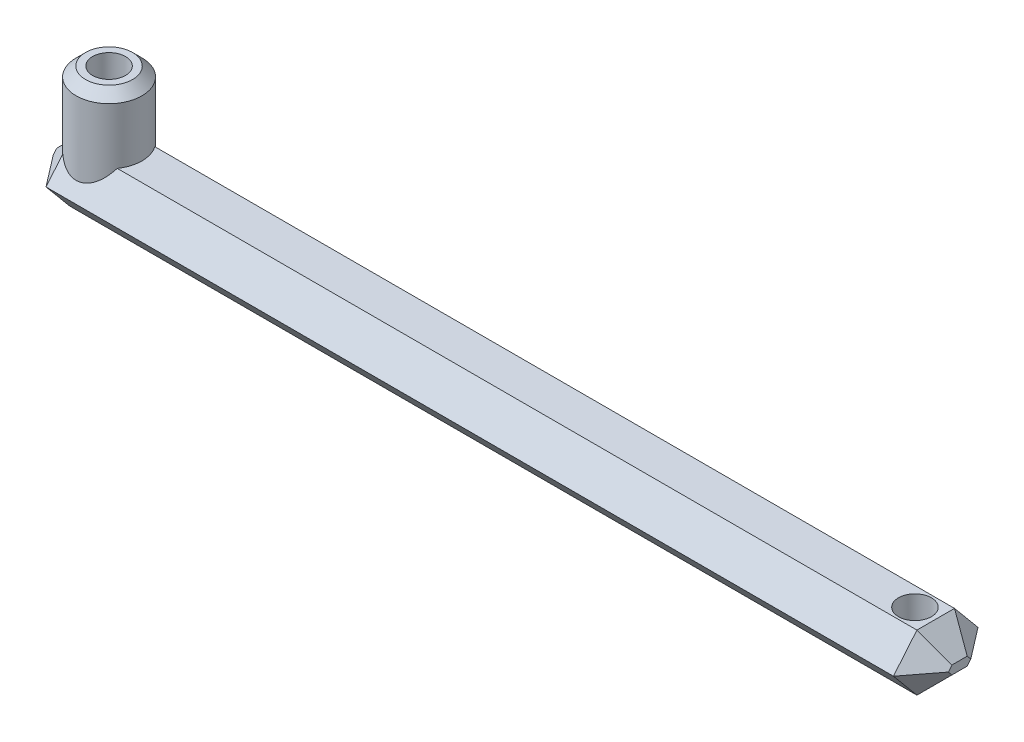
from build123d import *

# Parameters (mm, degrees)
BOSS_EXTRUDE1_DEPTH             = 47.625
SKETCH2_R                       = 1.75
CUT_EXTRUDE1_DEPTH              = 6
CHAMFER1_SIZE                   = 2.54
CHAMFER2_SIZE                   = 2.54
SKETCH3_R                       = 3.5
SKETCH3_R_2                     = 1.75
BOSS_EXTRUDE2_DEPTH             = 7
BOSS_EXTRUDE2_DIRECTION_2_REACH = 50.212
CHAMFER3_SIZE                   = 1


with BuildPart() as part:
    # Sketch1 → Boss-Extrude1 (new, symmetric)
    with BuildSketch(Plane(origin=(0, 0, 0), x_dir=(0, 0, -1), z_dir=(1, 0, 0))):
        Polygon((-2, -3), (-4.5, 0), (-2, 3), (2, 3), (4.5, 0), (2, -3), align=None)
    extrude(amount=BOSS_EXTRUDE1_DEPTH, both=True)

    # Sketch2 → Cut-Extrude1 (cut)
    with BuildSketch(Plane.XZ.offset(3)):
        with Locations(Location((42.875, 0, 0), (0, 0, 270))):
            Circle(SKETCH2_R)
    cut_extrude1 = extrude(amount=-CUT_EXTRUDE1_DEPTH, mode=Mode.SUBTRACT)

    # Chamfer1
    chamfer1_edges = [part.edges().sort_by_distance(p)[0] for p in [
        (47.625, -1.5, -3.25),
        (47.625, -3, 0),
        (47.625, -1.5, 3.25),
        (47.625, 1.5, 3.25),
        (47.625, 3, 0),
        (47.625, 1.5, -3.25),
    ]]
    chamfer(chamfer1_edges, length=CHAMFER1_SIZE)

    # Mirror4: Cut-Extrude1 across plane
    add(cut_extrude1.mirror(Plane(origin=(0, 0, 0), x_dir=(0, 0, 1), z_dir=(1, 0, 0))), mode=Mode.SUBTRACT)

    # Chamfer2
    chamfer2_edges = [part.edges().sort_by_distance(p)[0] for p in [
        (-47.625, 1.5, 3.25),
        (-47.625, -1.5, 3.25),
        (-47.625, -3, 0),
        (-47.625, -1.5, -3.25),
        (-47.625, 1.5, -3.25),
        (-47.625, 3, 0),
    ]]
    chamfer(chamfer2_edges, length=CHAMFER2_SIZE)

    # Sketch3 → Boss-Extrude2 (add)
    with BuildSketch(Plane(origin=(0, 3, 0), x_dir=(1, 0, 0), z_dir=(0, 1, 0))):
        with Locations(Location((-42.875, 0, 0), (0, 0, 270))):
            Circle(SKETCH3_R)
        with Locations(Location((-42.875, 0, 0), (0, 0, 90))):
            Circle(SKETCH3_R_2, mode=Mode.SUBTRACT)
    extrude(amount=BOSS_EXTRUDE2_DEPTH)

    # Sketch3 → Boss-Extrude2 direction 2 (add, up to next)
    with BuildSketch(Plane(origin=(0, 3, 0), x_dir=(1, 0, 0), z_dir=(0, 1, 0)), mode=Mode.PRIVATE) as boss_extrude2_direction_2_sk1:
        with Locations(Location((-42.875, 0, 0), (0, 0, 270))):
            Circle(SKETCH3_R)
        with Locations(Location((-42.875, 0, 0), (0, 0, 90))):
            Circle(SKETCH3_R_2, mode=Mode.SUBTRACT)
    boss_extrude2_direction_2_tool1 = extrude(boss_extrude2_direction_2_sk1.sketch, amount=-BOSS_EXTRUDE2_DIRECTION_2_REACH, mode=Mode.PRIVATE) - part.part
    add(boss_extrude2_direction_2_tool1.solids().sort_by_distance((-42.875, 3, -3.401005))[0])

    # Chamfer3
    chamfer3_edges = [part.edges().sort_by_distance(p)[0] for p in [
        (-42.875, 10, -3.5),
    ]]
    chamfer(chamfer3_edges, length=CHAMFER3_SIZE)


solid = part.part
